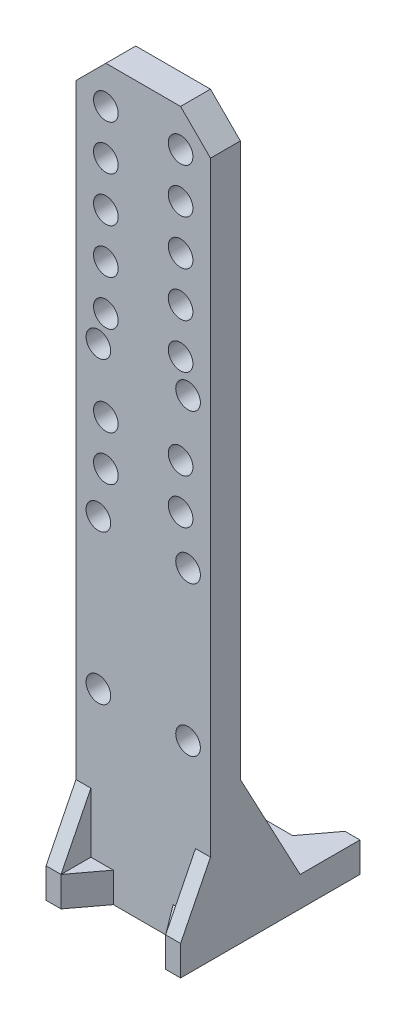
from build123d import *

# Parameters (mm, degrees)
SKETCH_1_W          = 18
SKETCH_1_H          = 16
EXTRUDE_1_DEPTH     = 4
SKETCH_2_R          = 1.65
CUT_EXTRUDE_1_DEPTH = 4
EXTRUDE_2_DEPTH     = 4
SKETCH_4_W          = 18
SKETCH_4_H          = 4
EXTRUDE_3_DEPTH     = 100
EXTRUDE_4_DEPTH     = 2
SKETCH_6_R          = 1.65
CUT_EXTRUDE_2_DEPTH = 10
SKETCH_7_W          = 18
SKETCH_7_H          = 7
CUT_EXTRUDE_3_DEPTH = 10
CHAMFER_1_SIZE      = 4


with BuildPart() as part:
    # 草图1 → 凸台-拉伸1 (new body)
    with BuildSketch(Plane(origin=(0, 0, 0), x_dir=(1, 0, 0), z_dir=(0, 1, 0))):
        Rectangle(SKETCH_1_W, SKETCH_1_H)
    extrude(amount=EXTRUDE_1_DEPTH)

    # 草图2 → 切除-拉伸1 (cut)
    with BuildSketch(Plane(origin=(0, 4, 0), x_dir=(1, 0, 0), z_dir=(0, 1, 0))):
        with Locations(Location((0, 0, 0), (0, 0, 270))):
            Circle(SKETCH_2_R)
    extrude(amount=-CUT_EXTRUDE_1_DEPTH, mode=Mode.SUBTRACT)

    # 草图3 → 凸台-拉伸2 (add)
    with BuildSketch(Plane(origin=(0, 4, 0), x_dir=(1, 0, 0), z_dir=(0, 1, 0))):
        Polygon((-9, -8), (-9, -12), (-7, -12), (-4, -8), align=None)
        Polygon((7, -12), (4, -8), (9, -8), (9, -12), align=None)
        Polygon((9, 12), (7, 12), (4, 8), (9, 8), align=None)
        Polygon((-7, 12), (-4, 8), (-9, 8), (-9, 12), align=None)
    extrude(amount=-EXTRUDE_2_DEPTH)

    # 草图4 → 凸台-拉伸3 (add)
    with BuildSketch(Plane(origin=(0, 4, 0), x_dir=(1, 0, 0), z_dir=(0, 1, 0))):
        with Locations((0, -6)):
            Rectangle(SKETCH_4_W, SKETCH_4_H)
    extrude(amount=EXTRUDE_3_DEPTH)

    # 草图5 → 凸台-拉伸4 (add)
    with BuildSketch(Plane(origin=(9, 0, 0), x_dir=(0, 0, -1), z_dir=(1, 0, 0))):
        Polygon((-4, 19), (-4, 4), (4, 4), align=None)
        Polygon((-8, 12), (-8, 4), (-12, 4), align=None)
    extrude_4 = extrude(amount=-EXTRUDE_4_DEPTH)

    # 镜向1: 凸台-拉伸4 across plane
    add(extrude_4.mirror(Plane(origin=(0, 0, 0), x_dir=(0, 0, 1), z_dir=(1, 0, 0))))

    # 草图6 → 切除-拉伸2 (cut)
    with BuildSketch(Plane(origin=(0, 0, 4), x_dir=(-1, 0, 0), z_dir=(0, 0, -1))):
        with Locations((-6, 44)):
            Circle(SKETCH_6_R)
        with Locations((6, 44)):
            Circle(SKETCH_6_R)
        with Locations((6, 64)):
            Circle(SKETCH_6_R)
        with Locations((-6, 64)):
            Circle(SKETCH_6_R)
        with Locations((6, 24)):
            Circle(SKETCH_6_R)
        with Locations((-6, 24)):
            Circle(SKETCH_6_R)
        with Locations((5, 92)):
            Circle(SKETCH_6_R)
        with Locations((5, 86)):
            Circle(SKETCH_6_R)
        with Locations((5, 80)):
            Circle(SKETCH_6_R)
        with Locations((5, 74)):
            Circle(SKETCH_6_R)
        with Locations((5, 68)):
            Circle(SKETCH_6_R)
        with Locations((5, 56)):
            Circle(SKETCH_6_R)
        with Locations((5, 50)):
            Circle(SKETCH_6_R)
        with Locations((-5, 50)):
            Circle(SKETCH_6_R)
        with Locations((-5, 56)):
            Circle(SKETCH_6_R)
        with Locations((-5, 68)):
            Circle(SKETCH_6_R)
        with Locations((-5, 74)):
            Circle(SKETCH_6_R)
        with Locations((-5, 80)):
            Circle(SKETCH_6_R)
        with Locations((-5, 86)):
            Circle(SKETCH_6_R)
        with Locations((-5, 92)):
            Circle(SKETCH_6_R)
    extrude(amount=-CUT_EXTRUDE_2_DEPTH, mode=Mode.SUBTRACT)

    # 草图7 → 切除-拉伸3 (cut)
    with BuildSketch(Plane(origin=(0, 0, 4), x_dir=(-1, 0, 0), z_dir=(0, 0, -1))):
        with Locations((0, 100.5)):
            Rectangle(SKETCH_7_W, SKETCH_7_H)
    extrude(amount=-CUT_EXTRUDE_3_DEPTH, mode=Mode.SUBTRACT)

    # 倒角1
    chamfer_1_edges = [part.edges().sort_by_distance(p)[0] for p in [
        (-9, 97, 6),
        (9, 97, 6),
    ]]
    chamfer(chamfer_1_edges, length=CHAMFER_1_SIZE)


solid = part.part
